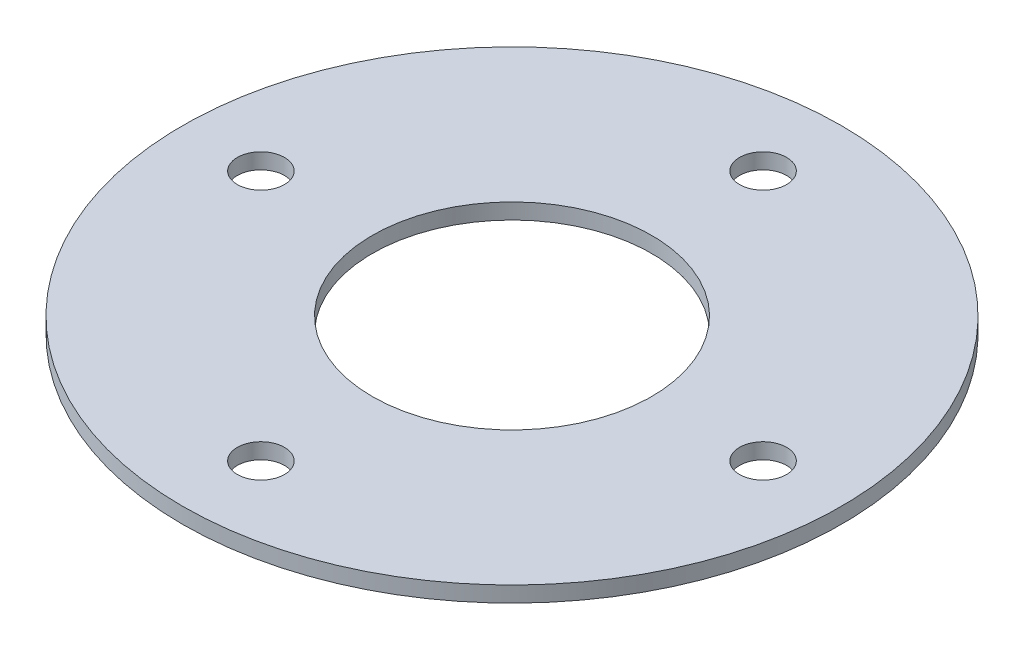
from build123d import *

# Parameters (mm, degrees)
SKETCH1_R           = 21
SKETCH1_R_2         = 8.9
SKETCH1_R_3         = 1.5
BOSS_EXTRUDE1_DEPTH = 1


with BuildPart() as part:
    # Sketch1 → Boss-Extrude1 (new body)
    with BuildSketch(Plane(origin=(0, 0, 0), x_dir=(1, 0, 0), z_dir=(0, 1, 0))):
        with Locations(Location((0, 0, 0), (0, 0, 270))):
            Circle(SKETCH1_R)
        with Locations(Location((0, 0, 0), (0, 0, 270))):
            Circle(SKETCH1_R_2, mode=Mode.SUBTRACT)
        with Locations(Location((0, 16, 0), (0, 0, 270))):
            Circle(SKETCH1_R_3, mode=Mode.SUBTRACT)
        with Locations(Location((16, 0, 0), (0, 0, 270))):
            Circle(SKETCH1_R_3, mode=Mode.SUBTRACT)
        with Locations(Location((0, -16, 0), (0, 0, 270))):
            Circle(SKETCH1_R_3, mode=Mode.SUBTRACT)
        with Locations(Location((-16, 0, 0), (0, 0, 270))):
            Circle(SKETCH1_R_3, mode=Mode.SUBTRACT)
    extrude(amount=BOSS_EXTRUDE1_DEPTH)


solid = part.part
